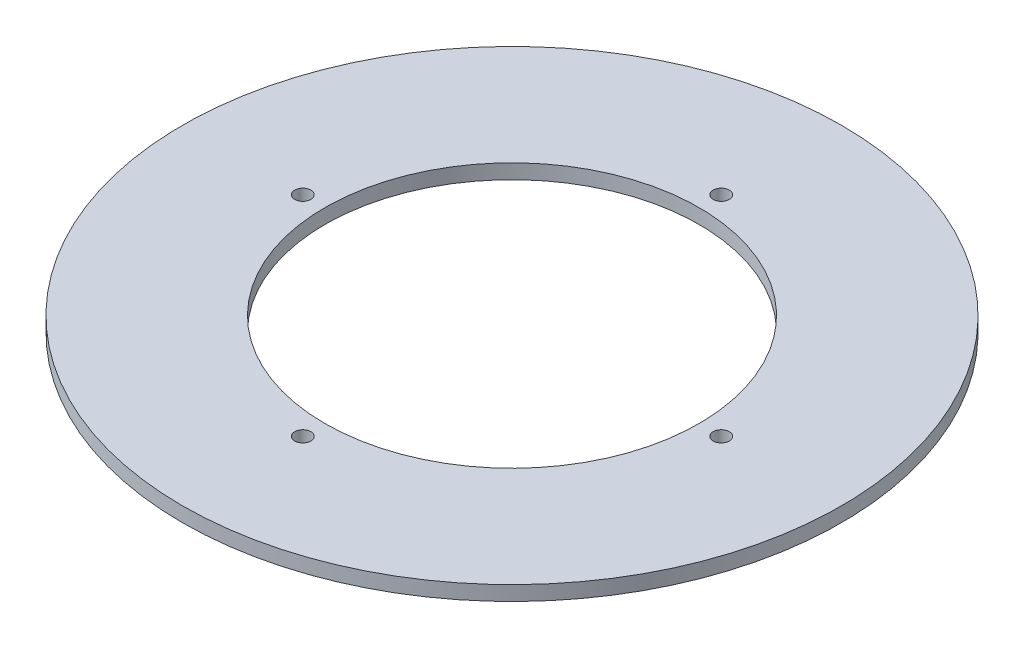
from build123d import *

# Parameters (mm, degrees)
CROQUIS1_R              = 91.36
CROQUIS1_R_2            = 51.86
CROQUIS1_R_3            = 2.25
SALIENTE_EXTRUIR1_DEPTH = 4.06


with BuildPart() as part:
    # Croquis1 → Saliente-Extruir1 (new body)
    with BuildSketch(Plane(origin=(0, 0, 0), x_dir=(1, 0, 0), z_dir=(0, 1, 0))):
        with Locations(Location((0, 0, 0), (0, 0, 270))):
            Circle(CROQUIS1_R)
        with Locations(Location((0, 0, 0), (0, 0, 270))):
            Circle(CROQUIS1_R_2, mode=Mode.SUBTRACT)
        with Locations(Location((-58, 0, 0), (0, 0, 270))):
            Circle(CROQUIS1_R_3, mode=Mode.SUBTRACT)
        with Locations(Location((0, 58, 0), (0, 0, 270))):
            Circle(CROQUIS1_R_3, mode=Mode.SUBTRACT)
        with Locations(Location((58, 0, 0), (0, 0, 270))):
            Circle(CROQUIS1_R_3, mode=Mode.SUBTRACT)
        with Locations(Location((0, -58, 0), (0, 0, 270))):
            Circle(CROQUIS1_R_3, mode=Mode.SUBTRACT)
    extrude(amount=SALIENTE_EXTRUIR1_DEPTH)


solid = part.part
